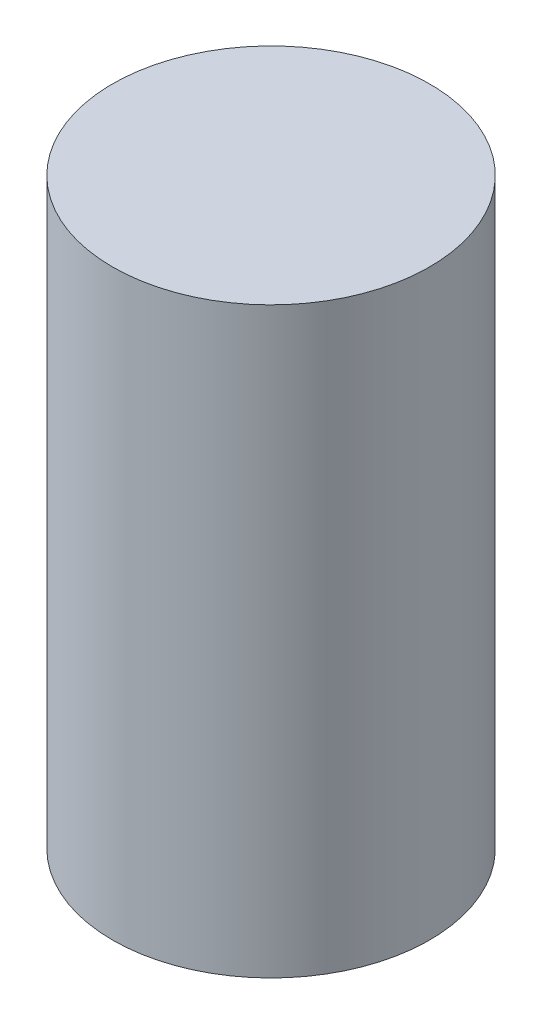
from build123d import *

# Parameters (mm, degrees)
SKETCH2_R           = 68
BOSS_EXTRUDE3_DEPTH = 250


with BuildPart() as part:
    # Sketch2 → Boss-Extrude3 (new body)
    with BuildSketch(Plane(origin=(0, 0, 0), x_dir=(1, 0, 0), z_dir=(0, 1, 0))):
        with Locations(Location((0, 0, 0), (0, 0, 270))):
            Circle(SKETCH2_R)
    extrude(amount=BOSS_EXTRUDE3_DEPTH)


solid = part.part
